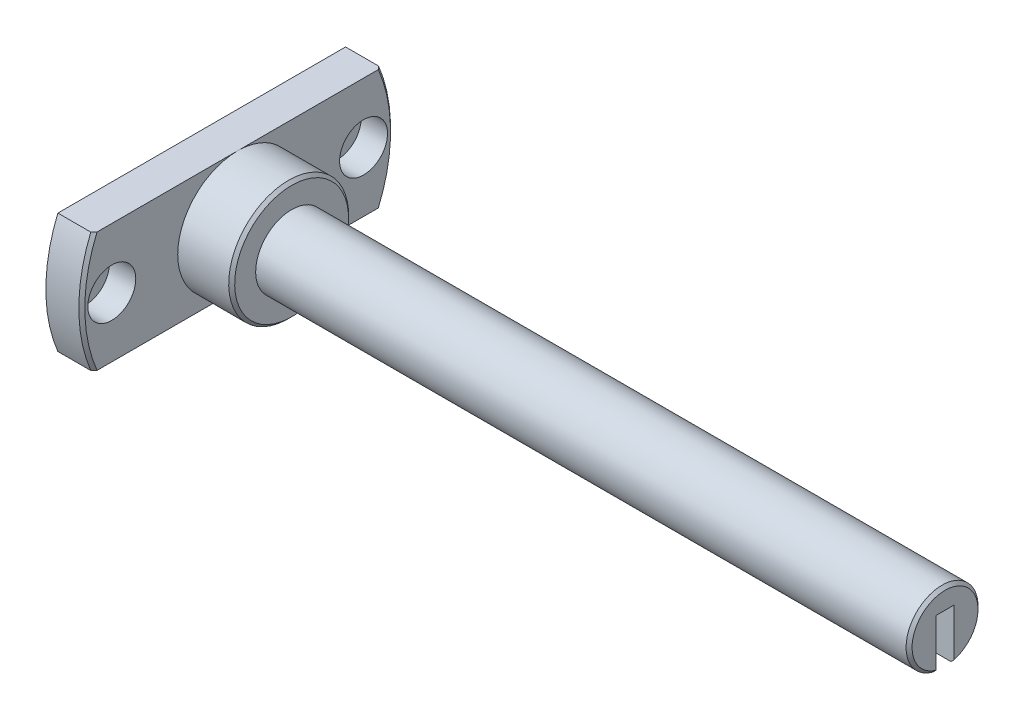
from build123d import *

# Parameters (mm, degrees)
CHANFREIN1_SIZE                                    = 0.5
CHAMBRAGE_POUR_VIS_T_TE_HEXAGONALE_M41_D           = 4.5
CHAMBRAGE_POUR_VIS_T_TE_HEXAGONALE_M41_CBORE_D     = 8
CHAMBRAGE_POUR_VIS_T_TE_HEXAGONALE_M41_CBORE_DEPTH = 4.4
ENL_V_MAT_EXTRU_2_DEPTH                            = 130.336769714
CHANFREIN3_SIZE                                    = 0.5
ESQUISSE12_W                                       = 3
ESQUISSE12_H                                       = 11.621091342
ENL_V_MAT_EXTRU_3_DEPTH                            = 3
D_GAGEMENT_M21_D                                   = 2.4
D_GAGEMENT_M21_DEPTH                               = 5
D_GAGEMENT_M21_TIP                                 = 0.692820323


with BuildPart() as part:
    # Esquisse1 → Révolution1 (revolve)
    with BuildSketch(Plane.XY):
        Polygon((15, 6), (124, 6), (124, 0), (0, 0), (0, 26), (6, 26), (6, 10), (15, 10), align=None)
    revolve(axis=Axis((124, 0, 0), (-1, 0, 0)))

    # Chanfrein1
    chanfrein1_edges = [part.edges().sort_by_distance(p)[0] for p in [
        (6, -26, 0),
        (15, -10, 0),
    ]]
    chamfer(chanfrein1_edges, length=CHANFREIN1_SIZE)

    # Chambrage pour vis à tête hexagonale M41 (through all)
    with Locations(Plane(origin=(6, 0, 0), x_dir=(0, 0, -1), z_dir=(1, 0, 0))):
        with Locations((-21, 0), (21, 0)):
            CounterBoreHole(CHAMBRAGE_POUR_VIS_T_TE_HEXAGONALE_M41_D / 2, CHAMBRAGE_POUR_VIS_T_TE_HEXAGONALE_M41_CBORE_D / 2, CHAMBRAGE_POUR_VIS_T_TE_HEXAGONALE_M41_CBORE_DEPTH)

    # Esquisse11 → Enlèv. mat.-Extru.2 (cut, through all)
    with BuildSketch(Plane.ZY):
        with BuildLine():
            Line((24, -10), (-24, -10))
            ThreePointArc((-24, -10), (0, -26), (24, -10))
        make_face()
        with BuildLine():
            Line((24, 10), (-24, 10))
            ThreePointArc((-24, 10), (0, 26), (24, 10))
        make_face()
    extrude(amount=-ENL_V_MAT_EXTRU_2_DEPTH, mode=Mode.SUBTRACT)

    # Chanfrein3
    chanfrein3_edges = [part.edges().sort_by_distance(p)[0] for p in [
        (124, -6, 0),
    ]]
    chamfer(chanfrein3_edges, length=CHANFREIN3_SIZE)

    # Esquisse12 → Enlèv. mat.-Extru.3 (cut)
    with BuildSketch(Plane(origin=(124, 0, 0), x_dir=(0, 0, -1), z_dir=(1, 0, 0))):
        with Locations((0, -3.191920072)):
            Rectangle(ESQUISSE12_W, ESQUISSE12_H)
    extrude(amount=-ENL_V_MAT_EXTRU_3_DEPTH, mode=Mode.SUBTRACT)

    # Dégagement M21
    with Locations(Plane(origin=(121, 0, 0), x_dir=(0, 0, -1), z_dir=(1, 0, 0))):
        with Locations((0, 0), (0, -3.724850959)):
            Hole(D_GAGEMENT_M21_D / 2, depth=D_GAGEMENT_M21_DEPTH)
            with Locations((0, 0, -(D_GAGEMENT_M21_DEPTH + D_GAGEMENT_M21_TIP / 2))):  # 120° drill point
                Cone(0, D_GAGEMENT_M21_D / 2, D_GAGEMENT_M21_TIP, mode=Mode.SUBTRACT)


solid = part.part
